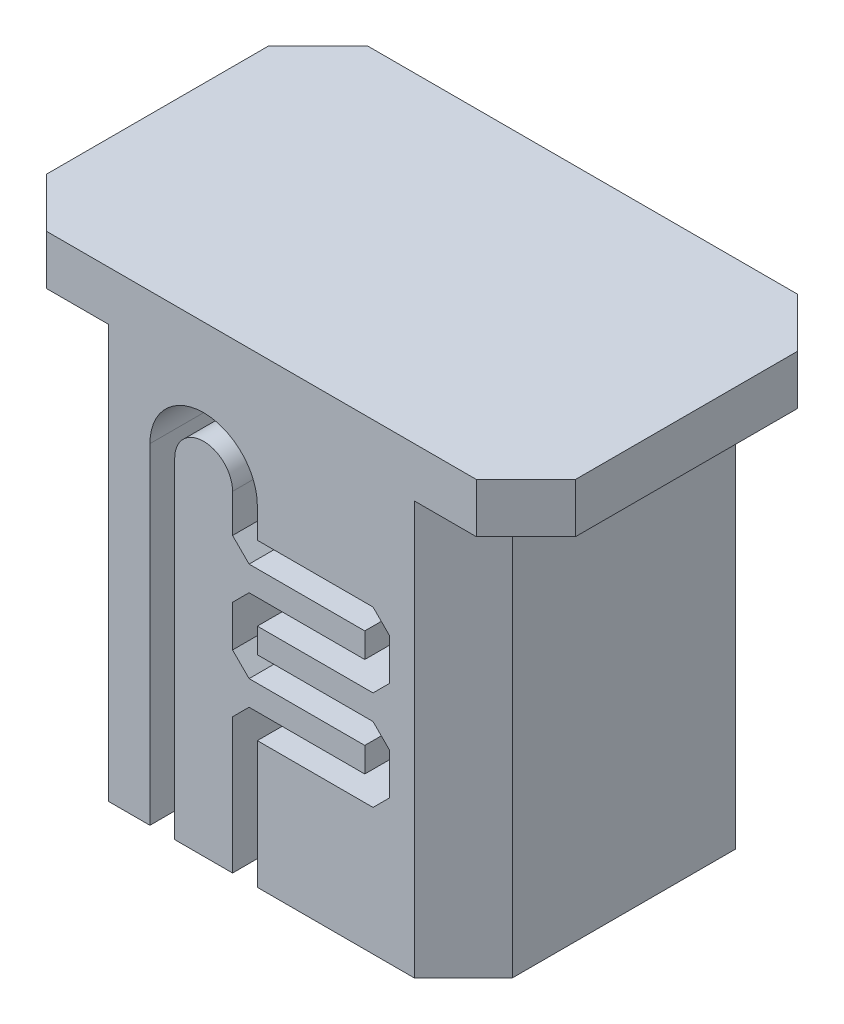
from build123d import *

# Parameters (mm, degrees)
BOSS_EXTRUDE1_DEPTH          = 25
CUT_EXTRUDE_THIN1_DEPTH      = 40.986996748
CUT_EXTRUDE_THIN1_DEPTH_BACK = 8.5
CUT_EXTRUDE_THIN3_DEPTH      = 40.986996748
CUT_EXTRUDE_THIN3_DEPTH_BACK = 8.5
SKETCH5_W                    = 32
SKETCH5_H                    = 19.425554826
BOSS_EXTRUDE2_DEPTH          = 3
CHAMFER3_SIZE                = 3
CHAMFER4_SIZE                = 1


with BuildPart() as part:
    # Sketch2 → Boss-Extrude1 (new body)
    with BuildSketch(Plane(origin=(0, 0, 0), x_dir=(1, 0, 0), z_dir=(0, 1, 0))):
        Polygon((0, 0), (0, 13.5), (2.962777413, 16.462777413), (21.462777413, 16.462777413), (24.425554826, 13.5), (24.425554826, 0), (21.462777413, -2.962777413), (2.962777413, -2.962777413), align=None)
    extrude(amount=BOSS_EXTRUDE1_DEPTH)

    # Sketch3 → Cut-Extrude-Thin1 (cut, two sides: drawn at the far end of the back side and taken through both)
    with BuildSketch(Plane.XY.offset(2.962777413).offset(-CUT_EXTRUDE_THIN1_DEPTH_BACK)):
        with BuildLine():
            Line((6.962777413, 0), (6.962777413, 20))
            ThreePointArc((6.962777413, 20), (8.712777413, 21.75), (10.462777413, 20))
            Line((10.462777413, 20), (10.462777413, 16.688890745))
            Line((10.462777413, 16.688890745), (18.462777413, 16.688890745))
            Line((18.462777413, 16.688890745), (18.462777413, 15.188890745))
            Line((18.462777413, 15.188890745), (10.462777413, 15.188890745))
            Line((10.462777413, 15.188890745), (10.462777413, 10.688890745))
            Line((10.462777413, 10.688890745), (18.462777413, 10.688890745))
            Line((18.462777413, 10.688890745), (18.462777413, 9.188890745))
            Line((18.462777413, 9.188890745), (10.462777413, 9.188890745))
            Line((10.462777413, 9.188890745), (10.462777413, 0))
            Line((10.462777413, 0), (11.962777413, 0))
            Line((11.962777413, 0), (11.962777413, 7.688890745))
            Line((11.962777413, 7.688890745), (19.962777413, 7.688890745))
            Line((19.962777413, 7.688890745), (19.962777413, 12.188890745))
            Line((19.962777413, 12.188890745), (11.962777413, 12.188890745))
            Line((11.962777413, 12.188890745), (11.962777413, 13.688890745))
            Line((11.962777413, 13.688890745), (19.962777413, 13.688890745))
            Line((19.962777413, 13.688890745), (19.962777413, 18.188890745))
            Line((19.962777413, 18.188890745), (11.962777413, 18.188890745))
            Line((11.962777413, 18.188890745), (11.962777413, 20))
            ThreePointArc((11.962777413, 20), (8.712777413, 23.25), (5.462777413, 20))
            Line((5.462777413, 20), (5.462777413, 0))
            Line((5.462777413, 0), (6.962777413, 0))
        make_face()
    extrude(amount=CUT_EXTRUDE_THIN1_DEPTH + CUT_EXTRUDE_THIN1_DEPTH_BACK, mode=Mode.SUBTRACT)

    # Sketch4 → Cut-Extrude-Thin3 (cut, two sides: drawn at the far end of the back side and taken through both)
    with BuildSketch(Plane(origin=(0, 0, -16.462777413), x_dir=(-1, 0, 0), z_dir=(0, 0, -1)).offset(-CUT_EXTRUDE_THIN3_DEPTH_BACK)):
        with BuildLine():
            Line((-17.462777413, 0), (-17.462777413, 19.789881458))
            ThreePointArc((-17.462777413, 19.789881458), (-15.712777413, 21.539881458), (-13.962777413, 19.789881458))
            Line((-13.962777413, 19.789881458), (-13.962777413, 16.039881458))
            Line((-13.962777413, 16.039881458), (-5.962777413, 16.039881458))
            Line((-5.962777413, 16.039881458), (-5.962777413, 14.539881458))
            Line((-5.962777413, 14.539881458), (-13.962777413, 14.539881458))
            Line((-13.962777413, 14.539881458), (-13.962777413, 10.039881458))
            Line((-13.962777413, 10.039881458), (-5.962777413, 10.039881458))
            Line((-5.962777413, 10.039881458), (-5.962777413, 8.539881458))
            Line((-5.962777413, 8.539881458), (-13.962777413, 8.539881458))
            Line((-13.962777413, 8.539881458), (-13.962777413, 0))
            Line((-13.962777413, 0), (-12.462777413, 0))
            Line((-12.462777413, 0), (-12.462777413, 7.039881458))
            Line((-12.462777413, 7.039881458), (-4.462777413, 7.039881458))
            Line((-4.462777413, 7.039881458), (-4.462777413, 11.539881458))
            Line((-4.462777413, 11.539881458), (-12.462777413, 11.539881458))
            Line((-12.462777413, 11.539881458), (-12.462777413, 13.039881458))
            Line((-12.462777413, 13.039881458), (-4.462777413, 13.039881458))
            Line((-4.462777413, 13.039881458), (-4.462777413, 17.539881458))
            Line((-4.462777413, 17.539881458), (-12.462777413, 17.539881458))
            Line((-12.462777413, 17.539881458), (-12.462777413, 19.789881458))
            ThreePointArc((-12.462777413, 19.789881458), (-15.712777413, 23.039881458), (-18.962777413, 19.789881458))
            Line((-18.962777413, 19.789881458), (-18.962777413, 0))
            Line((-18.962777413, 0), (-17.462777413, 0))
        make_face()
    extrude(amount=CUT_EXTRUDE_THIN3_DEPTH + CUT_EXTRUDE_THIN3_DEPTH_BACK, mode=Mode.SUBTRACT)

    # Sketch5 → Boss-Extrude2 (add)
    with BuildSketch(Plane(origin=(0, 25, 0), x_dir=(1, 0, 0), z_dir=(0, 1, 0))):
        with Locations((12.212777413, 6.75)):
            Rectangle(SKETCH5_W, SKETCH5_H)
    extrude(amount=BOSS_EXTRUDE2_DEPTH)

    # Chamfer3
    chamfer3_edges = [part.edges().sort_by_distance(p)[0] for p in [
        (28.212777413, 26.5, 2.962777413),
        (28.212777413, 26.5, -16.462777413),
        (-3.787222587, 26.5, -16.462777413),
        (-3.787222587, 26.5, 2.962777413),
    ]]
    chamfer(chamfer3_edges, length=CHAMFER3_SIZE)

    # Chamfer4
    chamfer4_edges = [part.edges().sort_by_distance(p)[0] for p in [
        (13.962777413, 8.539881458, -12.212777413),
        (4.462777413, 7.039881458, -12.212777413),
        (4.462777413, 11.539881458, -12.212777413),
        (4.462777413, 13.039881458, -12.212777413),
        (4.462777413, 17.539881458, -12.212777413),
        (13.962777413, 16.039881458, -12.212777413),
        (13.962777413, 14.539881458, -12.212777413),
        (13.962777413, 10.039881458, -12.212777413),
        (19.962777413, 7.688890745, -1.287222587),
        (19.962777413, 12.188890745, -1.287222587),
        (19.962777413, 13.688890745, -1.287222587),
        (19.962777413, 18.188890745, -1.287222587),
        (10.462777413, 16.688890745, -1.287222587),
        (10.462777413, 15.188890745, -1.287222587),
        (10.462777413, 10.688890745, -1.287222587),
        (10.462777413, 9.188890745, -1.287222587),
    ]]
    chamfer(chamfer4_edges, length=CHAMFER4_SIZE)


solid = part.part
